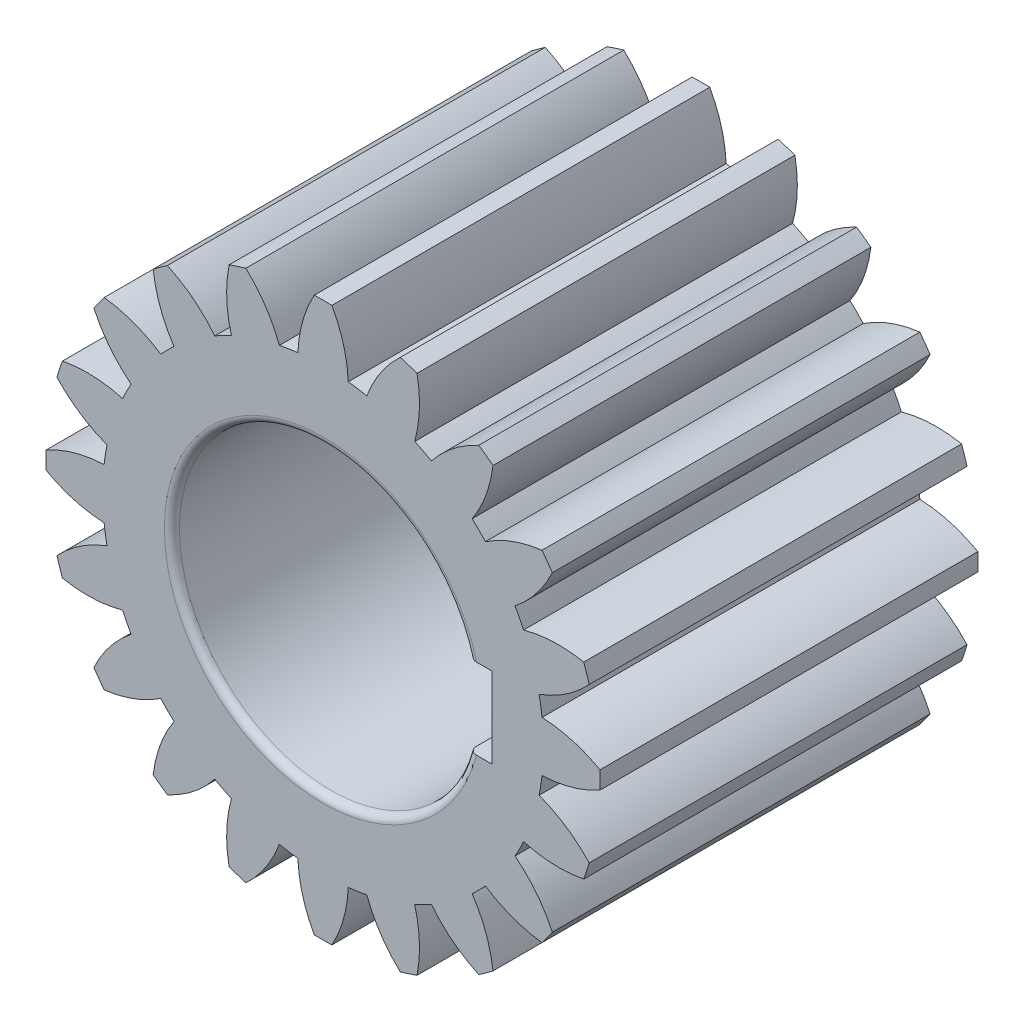
from build123d import *

# Parameters (mm, degrees)
SKETCH_1_R               = 87.5
EXTRUDE_1_DEPTH          = 150
EXTRUDE_2_DEPTH          = 150
PATTERN_CIRCULAR_1_COUNT = 20
CUT_EXTRUDE_1_DEPTH      = 217.10182785
FILLET_1_R               = 3


with BuildPart() as part:
    # 草图1 → 拉伸1 (new body)
    with BuildSketch(Plane.XY):
        Circle(SKETCH_1_R)
    extrude(amount=EXTRUDE_1_DEPTH)

    # 草图2 → 拉伸2 (add)
    with BuildSketch(Plane.XY):
        with BuildLine():
            ThreePointArc((10, 86.926693254), (0, 87.5), (-10, 86.926693254))
            ThreePointArc((-10, 86.926693254), (-8.101258535, 98.817083904), (-3.5, 109.944304082))
            ThreePointArc((-3.5, 109.944304082), (0, 110), (3.5, 109.944304082))
            ThreePointArc((3.5, 109.944304082), (8.101258535, 98.817083904), (10, 86.926693254))
        make_face()
    extrude_2 = extrude(amount=EXTRUDE_2_DEPTH)

    # 阵列(圆周)1: 拉伸2 ×20 about axis
    pattern_circular_1_axis = Axis((0, 0, 0), (0, 0, 1))
    for i in range(1, PATTERN_CIRCULAR_1_COUNT):
        add(extrude_2.rotate(pattern_circular_1_axis, i * 360 / PATTERN_CIRCULAR_1_COUNT))

    # 草图3 → 切除-拉伸1 (cut, through all)
    with BuildSketch(Plane.XY):
        with BuildLine():
            Line((57.827329179, 16), (67, 16))
            Line((67, 16), (67, -16))
            Line((67, -16), (57.827329179, -16))
            ThreePointArc((57.827329179, -16), (-60, 0), (57.827329179, 16))
        make_face()
    extrude(amount=CUT_EXTRUDE_1_DEPTH, mode=Mode.SUBTRACT)

    # 圆角1
    fillet_1_edges = [part.edges().sort_by_distance(p)[0] for p in [
        (-60, 0, 0),
        (-60, 0, 150),
    ]]
    fillet(fillet_1_edges, radius=FILLET_1_R)


solid = part.part
